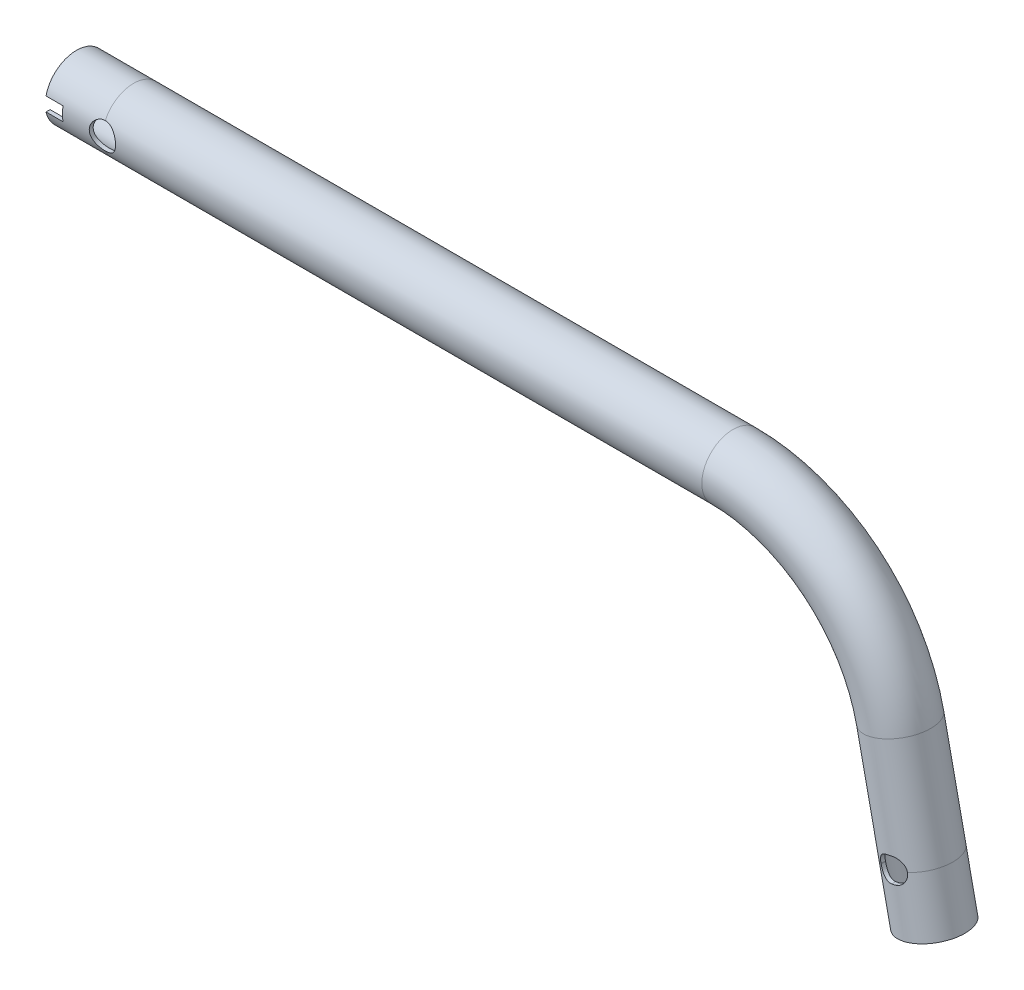
from build123d import *

# Parameters (mm, degrees)
SKETCH2_R                      = 9.5
SKETCH2_R_2                    = 8.3
CUT_EXTRUDE1_REACH             = 271.279
CUT_EXTRUDE1_DIRECTION_2_REACH = 271.279
CUT_EXTRUDE2_REACH             = 271.279
CUT_EXTRUDE2_END_RADIUS        = 9.5
SKETCH4_R                      = 4
CUT_EXTRUDE3_DEPTH             = 270.278770506
CUT_EXTRUDE3_DEPTH_BACK        = 270.278770506


with BuildPart() as part:
    # Sweep1: sweep along a path in Sketch1
    with BuildLine(Plane.XY) as sweep1_path:
        Line((-17.386538452, 0), (0, 0))
        Line((0, 0), (182.374601272, 0))
        ThreePointArc((182.374601272, 0), (215.099261607, -11.588410004), (233.23827651, -41.188592077))
        Line((233.23827651, -41.188592077), (240, -73))
        Line((240, -73), (243.613461548, -90))
    # Sketch2 → Sweep1 (sweep)
    with BuildSketch(Plane.ZY.offset(17.386538452)):
        Circle(SKETCH2_R)
        Circle(SKETCH2_R_2, mode=Mode.SUBTRACT)
    sweep(path=sweep1_path.line)

    # Sketch3 → Cut-Extrude1 (cut, up to next)
    with BuildSketch(Plane.XY, mode=Mode.PRIVATE) as cut_extrude1_sk1:
        with BuildLine():
            Line((244.027778512, -72.229297246), (243.993031815, -72.065826889))
            ThreePointArc((243.993031815, -72.065826889), (242.475751834, -69.858170819), (239.841824294, -69.370001204))
            Line((239.841824294, -69.370001204), (238.668047173, -69.619495233))
            ThreePointArc((238.668047173, -69.619495233), (236.460391103, -71.136775213), (235.972221488, -73.770702754))
            Line((235.972221488, -73.770702754), (236.006968185, -73.934173111))
            ThreePointArc((236.006968185, -73.934173111), (237.524248166, -76.141829181), (240.158175706, -76.629998796))
            Line((240.158175706, -76.629998796), (241.331952827, -76.380504767))
            ThreePointArc((241.331952827, -76.380504767), (243.539608897, -74.863224787), (244.027778512, -72.229297246))
        make_face()
    cut_extrude1_tool1 = extrude(cut_extrude1_sk1.sketch, amount=-CUT_EXTRUDE1_REACH, mode=Mode.PRIVATE) & part.part
    add(cut_extrude1_tool1.solids().sort_by_distance((240, -73, 0))[0], mode=Mode.SUBTRACT)

    # Sketch3 → Cut-Extrude1 direction 2 (cut, up to next)
    with BuildSketch(Plane.XY, mode=Mode.PRIVATE) as cut_extrude1_direction_2_sk1:
        with BuildLine():
            Line((244.027778512, -72.229297246), (243.993031815, -72.065826889))
            ThreePointArc((243.993031815, -72.065826889), (242.475751834, -69.858170819), (239.841824294, -69.370001204))
            Line((239.841824294, -69.370001204), (238.668047173, -69.619495233))
            ThreePointArc((238.668047173, -69.619495233), (236.460391103, -71.136775213), (235.972221488, -73.770702754))
            Line((235.972221488, -73.770702754), (236.006968185, -73.934173111))
            ThreePointArc((236.006968185, -73.934173111), (237.524248166, -76.141829181), (240.158175706, -76.629998796))
            Line((240.158175706, -76.629998796), (241.331952827, -76.380504767))
            ThreePointArc((241.331952827, -76.380504767), (243.539608897, -74.863224787), (244.027778512, -72.229297246))
        make_face()
    cut_extrude1_direction_2_tool1 = extrude(cut_extrude1_direction_2_sk1.sketch, amount=CUT_EXTRUDE1_DIRECTION_2_REACH, mode=Mode.PRIVATE) & part.part
    add(cut_extrude1_direction_2_tool1.solids().sort_by_distance((240, -73, 0))[0], mode=Mode.SUBTRACT)

    # Cut-Extrude2: up to this cylinder (the profile starts inside it)
    cut_extrude2_end = Plane(origin=(0, 0, 0), z_dir=(-1, 0, 0)) * Cylinder(CUT_EXTRUDE2_END_RADIUS, 562.558, mode=Mode.PRIVATE)
    # Sketch4 → Cut-Extrude2 (cut, up to the surface)
    with BuildSketch(Plane.XY, mode=Mode.PRIVATE) as cut_extrude2_sk1:
        with Locations(Location((0, 0, 0), (0, 0, 90))):
            Circle(SKETCH4_R)
    cut_extrude2_tool1 = extrude(cut_extrude2_sk1.sketch, amount=CUT_EXTRUDE2_REACH, mode=Mode.PRIVATE) & cut_extrude2_end
    add(cut_extrude2_tool1.solids().sort_by_distance((0, 0, 0))[0], mode=Mode.SUBTRACT)

    # Sketch5 → Cut-Extrude3 (cut, two sides: drawn at the far end of the back side and taken through both)
    with BuildSketch(Plane.XY.offset(-CUT_EXTRUDE3_DEPTH_BACK)):
        Polygon((-17.386538452, 0), (-17.386538452, 2.1), (-12.186538452, 2.1), (-12.186538452, -2.1), (-17.386538452, -2.1), align=None)
    extrude(amount=CUT_EXTRUDE3_DEPTH + CUT_EXTRUDE3_DEPTH_BACK, mode=Mode.SUBTRACT)


solid = part.part
